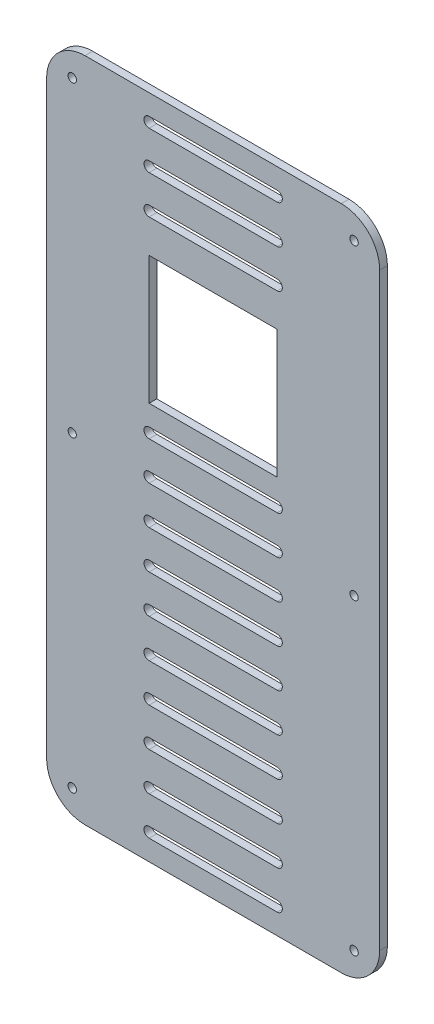
from build123d import *

# Parameters (mm, degrees)
SKETCH_1_W          = 130
SKETCH_1_H          = 260
EXTRUDE_1_DEPTH     = 3
SKETCH_2_R          = 1.65
SKETCH_2_R_2        = 1.6
SKETCH_2_R_3        = 1.605
CUT_EXTRUDE_1_DEPTH = 3
SKETCH_3_W          = 50
SKETCH_3_H          = 50
CUT_EXTRUDE_2_DEPTH = 10
FILLET_1_R          = 15
CUT_EXTRUDE_4_DEPTH = 10


with BuildPart() as part:
    # 草图1 → 凸台-拉伸1 (new body)
    with BuildSketch(Plane.XY):
        with Locations((65, 130)):
            Rectangle(SKETCH_1_W, SKETCH_1_H)
    extrude(amount=EXTRUDE_1_DEPTH)

    # 草图2 → 切除-拉伸1 (cut)
    with BuildSketch(Plane.XY.offset(3)):
        with Locations((120, 10)):
            Circle(SKETCH_2_R)
        with Locations((10, 10)):
            Circle(SKETCH_2_R)
        with Locations(Location((10, 250, 0), (0, 0, 180))):
            Circle(SKETCH_2_R)
        with Locations(Location((120, 250, 0), (0, 0, 180))):
            Circle(SKETCH_2_R)
        with Locations((120, 130)):
            Circle(SKETCH_2_R_2)
        with Locations((10, 130)):
            Circle(SKETCH_2_R_3)
    extrude(amount=-CUT_EXTRUDE_1_DEPTH, mode=Mode.SUBTRACT)

    # 草图3 → 切除-拉伸2 (cut)
    with BuildSketch(Plane(origin=(0, 0, 0), x_dir=(-1, 0, 0), z_dir=(0, 0, -1))):
        with Locations((-65, 180)):
            Rectangle(SKETCH_3_W, SKETCH_3_H)
    extrude(amount=-CUT_EXTRUDE_2_DEPTH, mode=Mode.SUBTRACT)

    # 圆角1
    fillet_1_edges = [part.edges().sort_by_distance(p)[0] for p in [
        (0, 0, 1.5),
        (130, 0, 1.5),
        (130, 260, 1.5),
        (0, 260, 1.5),
    ]]
    fillet(fillet_1_edges, radius=FILLET_1_R)

    # 草图4 → 切除-拉伸4 (cut)
    with BuildSketch(Plane(origin=(0, 0, 0), x_dir=(-1, 0, 0), z_dir=(0, 0, -1))):
        with BuildLine():
            Line((-90, 12), (-40, 12))
            ThreePointArc((-40, 12), (-38, 10), (-40, 8))
            Line((-40, 8), (-90, 8))
            ThreePointArc((-90, 8), (-92, 10), (-90, 12))
        make_face()
        with BuildLine():
            Line((-90, 27), (-40, 27))
            ThreePointArc((-40, 27), (-38, 25), (-40, 23))
            Line((-40, 23), (-90, 23))
            ThreePointArc((-90, 23), (-92, 25), (-90, 27))
        make_face()
        with BuildLine():
            Line((-90, 42), (-40, 42))
            ThreePointArc((-40, 42), (-38, 40), (-40, 38))
            Line((-40, 38), (-90, 38))
            ThreePointArc((-90, 38), (-92, 40), (-90, 42))
        make_face()
        with BuildLine():
            Line((-90, 57), (-40, 57))
            ThreePointArc((-40, 57), (-38, 55), (-40, 53))
            Line((-40, 53), (-90, 53))
            ThreePointArc((-90, 53), (-92, 55), (-90, 57))
        make_face()
        with BuildLine():
            Line((-90, 72), (-40, 72))
            ThreePointArc((-40, 72), (-38, 70), (-40, 68))
            Line((-40, 68), (-90, 68))
            ThreePointArc((-90, 68), (-92, 70), (-90, 72))
        make_face()
        with BuildLine():
            Line((-90, 87), (-40, 87))
            ThreePointArc((-40, 87), (-38, 85), (-40, 83))
            Line((-40, 83), (-90, 83))
            ThreePointArc((-90, 83), (-92, 85), (-90, 87))
        make_face()
        with BuildLine():
            Line((-90, 102), (-40, 102))
            ThreePointArc((-40, 102), (-38, 100), (-40, 98))
            Line((-40, 98), (-90, 98))
            ThreePointArc((-90, 98), (-92, 100), (-90, 102))
        make_face()
        with BuildLine():
            Line((-90, 117), (-40, 117))
            ThreePointArc((-40, 117), (-38, 115), (-40, 113))
            Line((-40, 113), (-90, 113))
            ThreePointArc((-90, 113), (-92, 115), (-90, 117))
        make_face()
        with BuildLine():
            Line((-90, 132), (-40, 132))
            ThreePointArc((-40, 132), (-38, 130), (-40, 128))
            Line((-40, 128), (-90, 128))
            ThreePointArc((-90, 128), (-92, 130), (-90, 132))
        make_face()
        with BuildLine():
            Line((-90, 147), (-40, 147))
            ThreePointArc((-40, 147), (-38, 145), (-40, 143))
            Line((-40, 143), (-90, 143))
            ThreePointArc((-90, 143), (-92, 145), (-90, 147))
        make_face()
        with BuildLine():
            Line((-90, 222), (-40, 222))
            ThreePointArc((-40, 222), (-38, 220), (-40, 218))
            Line((-40, 218), (-90, 218))
            ThreePointArc((-90, 218), (-92, 220), (-90, 222))
        make_face()
        with BuildLine():
            Line((-90, 237), (-40, 237))
            ThreePointArc((-40, 237), (-38, 235), (-40, 233))
            Line((-40, 233), (-90, 233))
            ThreePointArc((-90, 233), (-92, 235), (-90, 237))
        make_face()
        with BuildLine():
            Line((-90, 252), (-40, 252))
            ThreePointArc((-40, 252), (-38, 250), (-40, 248))
            Line((-40, 248), (-90, 248))
            ThreePointArc((-90, 248), (-92, 250), (-90, 252))
        make_face()
    extrude(amount=-CUT_EXTRUDE_4_DEPTH, mode=Mode.SUBTRACT)


solid = part.part
